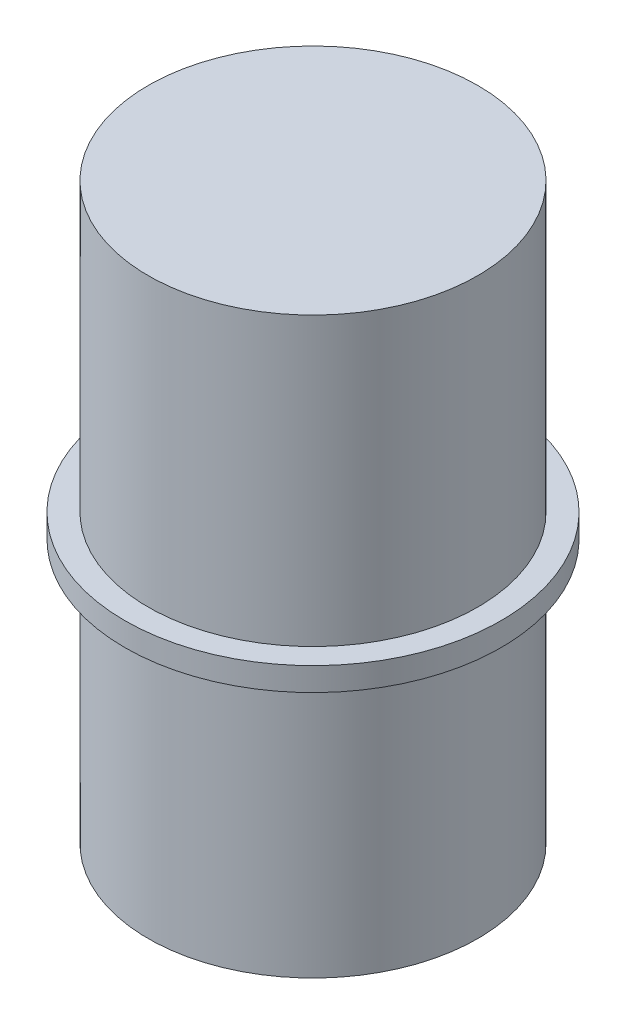
from build123d import *

# Parameters (mm, degrees)
SKETCH1_R           = 10.9347
BOSS_EXTRUDE1_DEPTH = 38.1
SKETCH5_W           = 1.55
SKETCH5_H           = 1.55


with BuildPart() as part:
    # Sketch1 → Boss-Extrude1 (new body)
    with BuildSketch(Plane(origin=(0, 0, 0), x_dir=(1, 0, 0), z_dir=(0, 1, 0))):
        with Locations(Location((0, 0, 0), (0, 0, 90))):
            Circle(SKETCH1_R)
    extrude(amount=BOSS_EXTRUDE1_DEPTH)

    # Sketch5 → Revolve1 (revolve)
    with BuildSketch(Plane.XY, mode=Mode.PRIVATE) as revolve1_sk:
        with Locations((-11.7097, 18.275)):
            Rectangle(SKETCH5_W, SKETCH5_H)
    revolve(revolve1_sk.sketch.rotate(Axis((0, 38.1, 0), (0, -1, 0)), 90), axis=Axis((0, 38.1, 0), (0, -1, 0)))


solid = part.part
